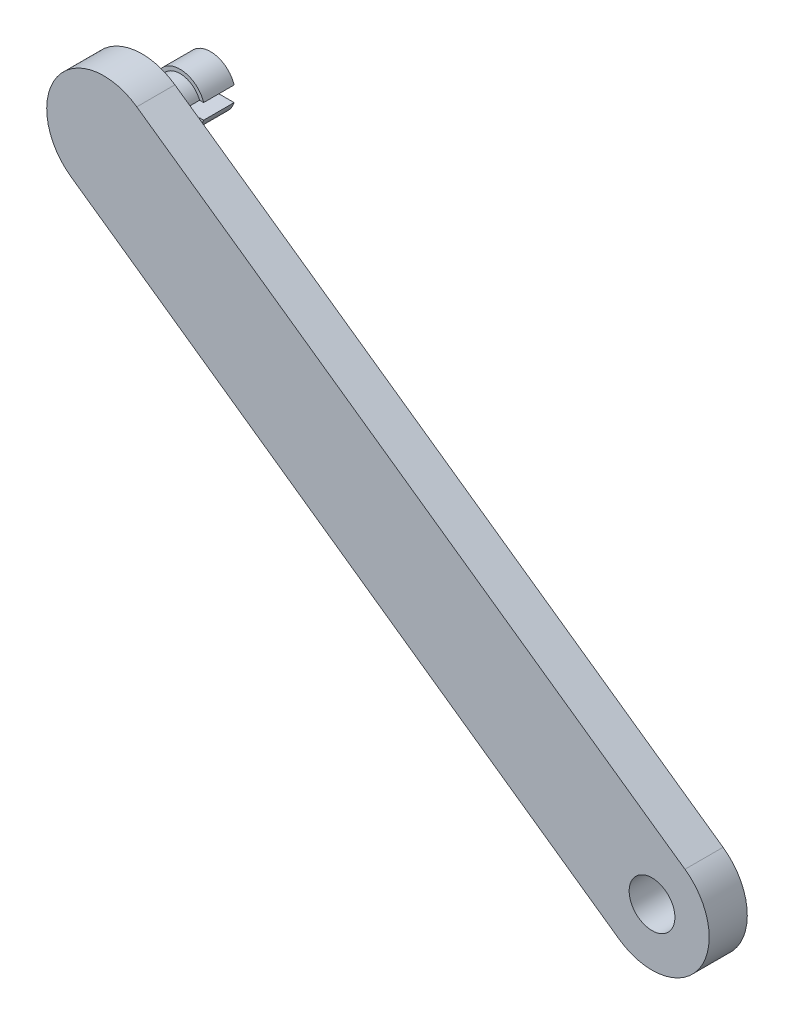
from build123d import *

# Parameters (mm, degrees)
BOSS_EXTRU_1_DEPTH      = 5
ESQUISSE2_R             = 3
ENL_V_MAT_EXTRU_1_DEPTH = 5
ESQUISSE3_R             = 2.75
BOSS_EXTRU_2_DEPTH      = 5
ESQUISSE4_R             = 3.25
BOSS_EXTRU_3_DEPTH      = 4
ESQUISSE5_W             = 10
ESQUISSE5_H             = 2
ENL_V_MAT_EXTRU_2_DEPTH = 9


with BuildPart() as part:
    # Esquisse1 → Boss.-Extru.1 (new body)
    with BuildSketch(Plane.XY):
        with BuildLine():
            Line((15.680221033, -6.131028436), (-56.257179278, 44.554378107))
            ThreePointArc((-56.257179278, 44.554378107), (-58.068428747, 55.00518551), (-47.617621345, 56.816434978))
            Line((-47.617621345, 56.816434978), (24.319778967, 6.131028436))
            ThreePointArc((24.319778967, 6.131028436), (26.131028436, -4.319778967), (15.680221033, -6.131028436))
        make_face()
    extrude(amount=BOSS_EXTRU_1_DEPTH)

    # Esquisse2 → Enlèv. mat.-Extru.1 (cut)
    with BuildSketch(Plane.XY.offset(5)):
        with Locations((20, 0)):
            Circle(ESQUISSE2_R)
    extrude(amount=-ENL_V_MAT_EXTRU_1_DEPTH, mode=Mode.SUBTRACT)

    # Esquisse3 → Boss.-Extru.2 (add)
    with BuildSketch(Plane(origin=(0, 0, 0), x_dir=(-1, 0, 0), z_dir=(0, 0, -1))):
        with Locations(Location((51.937400312, 50.685406543, 0), (0, 0, 180))):
            Circle(ESQUISSE3_R)
    extrude(amount=BOSS_EXTRU_2_DEPTH)

    # Esquisse4 → Boss.-Extru.3 (add)
    with BuildSketch(Plane(origin=(0, 0, -5), x_dir=(-1, 0, 0), z_dir=(0, 0, -1))):
        with Locations((51.937400312, 50.685406543)):
            Circle(ESQUISSE4_R)
    extrude(amount=BOSS_EXTRU_3_DEPTH)

    # Esquisse5 → Enlèv. mat.-Extru.2 (cut)
    with BuildSketch(Plane(origin=(0, 0, -9), x_dir=(-1, 0, 0), z_dir=(0, 0, -1))):
        with Locations((51.937400312, 50.685406543)):
            Rectangle(ESQUISSE5_W, ESQUISSE5_H)
    extrude(amount=-ENL_V_MAT_EXTRU_2_DEPTH, mode=Mode.SUBTRACT)


solid = part.part
